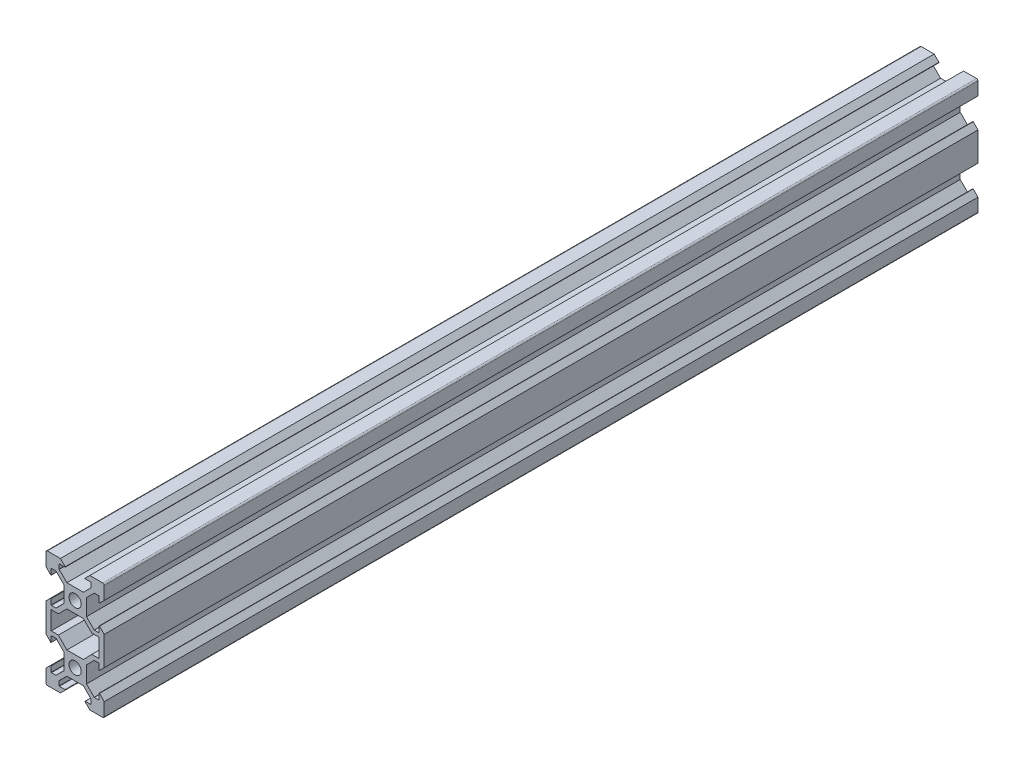
from build123d import *

# Parameters (mm, degrees)
SKETCH1_R           = 2.1
BOSS_EXTRUDE1_DEPTH = 300


with BuildPart() as part:
    # Sketch1 → Boss-Extrude1 (new body)
    with BuildSketch(Plane.XY):
        with BuildLine():
            ThreePointArc((10, 19.5), (9.853553391, 19.853553391), (9.5, 20))
            Line((9.5, 20), (5.049211356, 20))
            Line((5.049211356, 20), (3.419922035, 18.370710678))
            ThreePointArc((3.419922035, 18.370710678), (3.398244759, 18.261731657), (3.490632713, 18.2))
            Line((3.490632713, 18.2), (5.4, 18.2))
            ThreePointArc((5.4, 18.2), (5.470710678, 18.170710678), (5.5, 18.1))
            Line((5.5, 18.1), (5.5, 16.602081528))
            ThreePointArc((5.5, 16.602081528), (5.492387953, 16.563813185), (5.470710678, 16.53137085))
            Line((5.470710678, 16.53137085), (2.839339828, 13.9))
            Line((2.839339828, 13.9), (-2.839339828, 13.9))
            Line((-2.839339828, 13.9), (-5.470710678, 16.53137085))
            ThreePointArc((-5.470710678, 16.53137085), (-5.492387953, 16.563813185), (-5.5, 16.602081528))
            Line((-5.5, 16.602081528), (-5.5, 18.1))
            ThreePointArc((-5.5, 18.1), (-5.470710678, 18.170710678), (-5.4, 18.2))
            Line((-5.4, 18.2), (-3.490632713, 18.2))
            ThreePointArc((-3.490632713, 18.2), (-3.398244759, 18.261731657), (-3.419922035, 18.370710678))
            Line((-3.419922035, 18.370710678), (-5.049211356, 20))
            Line((-5.049211356, 20), (-9.5, 20))
            ThreePointArc((-9.5, 20), (-9.853553391, 19.853553391), (-10, 19.5))
            Line((-10, 19.5), (-10, 15.049211356))
            Line((-10, 15.049211356), (-8.370710678, 13.419922035))
            ThreePointArc((-8.370710678, 13.419922035), (-8.261731657, 13.398244759), (-8.2, 13.490632713))
            Line((-8.2, 13.490632713), (-8.2, 15.4))
            ThreePointArc((-8.2, 15.4), (-8.170710678, 15.470710678), (-8.1, 15.5))
            Line((-8.1, 15.5), (-6.602081528, 15.5))
            ThreePointArc((-6.602081528, 15.5), (-6.563813185, 15.492387953), (-6.53137085, 15.470710678))
            Line((-6.53137085, 15.470710678), (-3.9, 12.839339828))
            Line((-3.9, 12.839339828), (-3.9, 7.160660172))
            Line((-3.9, 7.160660172), (-6.53137085, 4.529289322))
            ThreePointArc((-6.53137085, 4.529289322), (-6.563813185, 4.507612047), (-6.602081528, 4.5))
            Line((-6.602081528, 4.5), (-8.1, 4.5))
            ThreePointArc((-8.1, 4.5), (-8.170710678, 4.529289322), (-8.2, 4.6))
            Line((-8.2, 4.6), (-8.2, 6.509367287))
            ThreePointArc((-8.2, 6.509367287), (-8.261731657, 6.601755241), (-8.370710678, 6.580077965))
            Line((-8.370710678, 6.580077965), (-10, 4.950788644))
            Line((-10, 4.950788644), (-10, -4.950788644))
            Line((-10, -4.950788644), (-8.370710678, -6.580077965))
            ThreePointArc((-8.370710678, -6.580077965), (-8.261731657, -6.601755241), (-8.2, -6.509367287))
            Line((-8.2, -6.509367287), (-8.2, -4.6))
            ThreePointArc((-8.2, -4.6), (-8.170710678, -4.529289322), (-8.1, -4.5))
            Line((-8.1, -4.5), (-6.602081528, -4.5))
            ThreePointArc((-6.602081528, -4.5), (-6.563813185, -4.507612047), (-6.53137085, -4.529289322))
            Line((-6.53137085, -4.529289322), (-3.9, -7.160660172))
            Line((-3.9, -7.160660172), (-3.9, -10))
            Line((-3.9, -10), (-3.9, -12.839339828))
            Line((-3.9, -12.839339828), (-6.53137085, -15.470710678))
            ThreePointArc((-6.53137085, -15.470710678), (-6.563813185, -15.492387953), (-6.602081528, -15.5))
            Line((-6.602081528, -15.5), (-8.1, -15.5))
            ThreePointArc((-8.1, -15.5), (-8.170710678, -15.470710678), (-8.2, -15.4))
            Line((-8.2, -15.4), (-8.2, -13.490632713))
            ThreePointArc((-8.2, -13.490632713), (-8.261731657, -13.398244759), (-8.370710678, -13.419922035))
            Line((-8.370710678, -13.419922035), (-10, -15.049211356))
            Line((-10, -15.049211356), (-10, -19.5))
            ThreePointArc((-10, -19.5), (-9.853553391, -19.853553391), (-9.5, -20))
            Line((-9.5, -20), (-5.049211356, -20))
            Line((-5.049211356, -20), (-3.419922035, -18.370710678))
            ThreePointArc((-3.419922035, -18.370710678), (-3.398244759, -18.261731657), (-3.490632713, -18.2))
            Line((-3.490632713, -18.2), (-5.4, -18.2))
            ThreePointArc((-5.4, -18.2), (-5.470710678, -18.170710678), (-5.5, -18.1))
            Line((-5.5, -18.1), (-5.5, -16.602081528))
            ThreePointArc((-5.5, -16.602081528), (-5.492387953, -16.563813185), (-5.470710678, -16.53137085))
            Line((-5.470710678, -16.53137085), (-2.839339828, -13.9))
            Line((-2.839339828, -13.9), (2.839339828, -13.9))
            Line((2.839339828, -13.9), (5.470710678, -16.53137085))
            ThreePointArc((5.470710678, -16.53137085), (5.492387953, -16.563813185), (5.5, -16.602081528))
            Line((5.5, -16.602081528), (5.5, -18.1))
            ThreePointArc((5.5, -18.1), (5.470710678, -18.170710678), (5.4, -18.2))
            Line((5.4, -18.2), (3.490632713, -18.2))
            ThreePointArc((3.490632713, -18.2), (3.398244759, -18.261731657), (3.419922035, -18.370710678))
            Line((3.419922035, -18.370710678), (5.049211356, -20))
            Line((5.049211356, -20), (9.5, -20))
            ThreePointArc((9.5, -20), (9.853553391, -19.853553391), (10, -19.5))
            Line((10, -19.5), (10, -15.049211356))
            Line((10, -15.049211356), (8.370710678, -13.419922035))
            ThreePointArc((8.370710678, -13.419922035), (8.261731657, -13.398244759), (8.2, -13.490632713))
            Line((8.2, -13.490632713), (8.2, -15.4))
            ThreePointArc((8.2, -15.4), (8.170710678, -15.470710678), (8.1, -15.5))
            Line((8.1, -15.5), (6.602081528, -15.5))
            ThreePointArc((6.602081528, -15.5), (6.563813185, -15.492387953), (6.53137085, -15.470710678))
            Line((6.53137085, -15.470710678), (3.9, -12.839339828))
            Line((3.9, -12.839339828), (3.9, -10))
            Line((3.9, -10), (3.9, -7.160660172))
            Line((3.9, -7.160660172), (6.53137085, -4.529289322))
            ThreePointArc((6.53137085, -4.529289322), (6.563813185, -4.507612047), (6.602081528, -4.5))
            Line((6.602081528, -4.5), (8.1, -4.5))
            ThreePointArc((8.1, -4.5), (8.170710678, -4.529289322), (8.2, -4.6))
            Line((8.2, -4.6), (8.2, -6.509367287))
            ThreePointArc((8.2, -6.509367287), (8.261731657, -6.601755241), (8.370710678, -6.580077965))
            Line((8.370710678, -6.580077965), (10, -4.950788644))
            Line((10, -4.950788644), (10, 4.950788644))
            Line((10, 4.950788644), (8.370710678, 6.580077965))
            ThreePointArc((8.370710678, 6.580077965), (8.261731657, 6.601755241), (8.2, 6.509367287))
            Line((8.2, 6.509367287), (8.2, 4.6))
            ThreePointArc((8.2, 4.6), (8.170710678, 4.529289322), (8.1, 4.5))
            Line((8.1, 4.5), (6.602081528, 4.5))
            ThreePointArc((6.602081528, 4.5), (6.563813185, 4.507612047), (6.53137085, 4.529289322))
            Line((6.53137085, 4.529289322), (3.9, 7.160660172))
            Line((3.9, 7.160660172), (3.9, 12.839339828))
            Line((3.9, 12.839339828), (6.53137085, 15.470710678))
            ThreePointArc((6.53137085, 15.470710678), (6.563813185, 15.492387953), (6.602081528, 15.5))
            Line((6.602081528, 15.5), (8.1, 15.5))
            ThreePointArc((8.1, 15.5), (8.170710678, 15.470710678), (8.2, 15.4))
            Line((8.2, 15.4), (8.2, 13.490632713))
            ThreePointArc((8.2, 13.490632713), (8.261731657, 13.398244759), (8.370710678, 13.419922035))
            Line((8.370710678, 13.419922035), (10, 15.049211356))
            Line((10, 15.049211356), (10, 19.5))
        make_face()
        with Locations((0, -10)):
            Circle(SKETCH1_R, mode=Mode.SUBTRACT)
        Polygon((-5.735302207, 3.204037621), (-2.839339828, 6.1), (2.839339828, 6.1), (5.735302207, 3.204037621), (8.2, 3.204037621), (8.2, -3.117547571), (5.735302207, -3.117547571), (2.839339828, -6.1), (-2.839339828, -6.1), (-5.735302207, -3.117547571), (-8.2, -3.117547571), (-8.2, 3.204037621), align=None, mode=Mode.SUBTRACT)
        with Locations((0, 10)):
            Circle(SKETCH1_R, mode=Mode.SUBTRACT)
    extrude(amount=BOSS_EXTRUDE1_DEPTH)


solid = part.part
